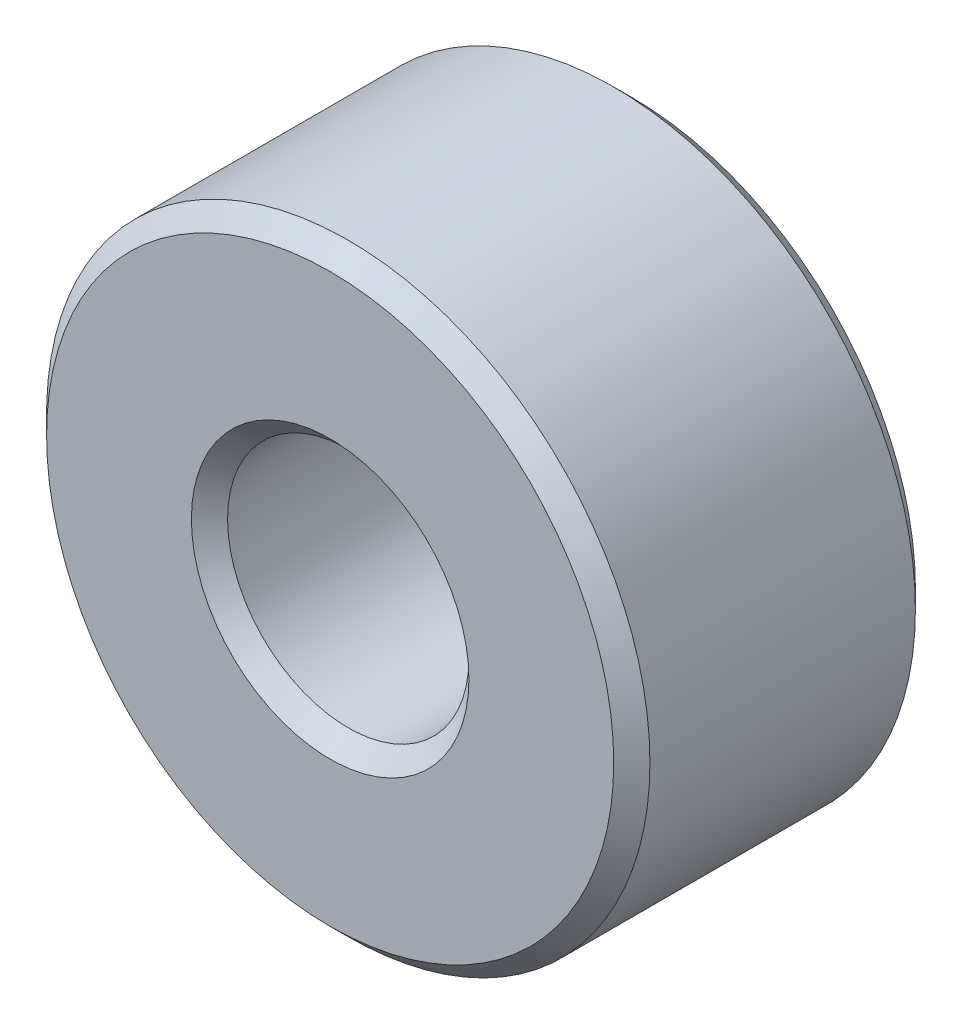
from build123d import *

# Parameters (mm, degrees)
BOSS_EXTRUDE1_DEPTH      = 2
BOSS_EXTRUDE1_DEPTH_BACK = 2
SKETCH3_R                = 4
SKETCH3_R_2              = 1.6
CHAMFER1_SIZE            = 0.24


with BuildPart() as part:
    # Sketch3 → Boss-Extrude1 (new, two sides: drawn at the far end of the back side and taken through both)
    with BuildSketch(Plane.XY.offset(-BOSS_EXTRUDE1_DEPTH_BACK)):
        Circle(SKETCH3_R)
        Circle(SKETCH3_R_2, mode=Mode.SUBTRACT)
    extrude(amount=BOSS_EXTRUDE1_DEPTH + BOSS_EXTRUDE1_DEPTH_BACK)

    # Chamfer1
    chamfer1_edges = [part.edges().sort_by_distance(p)[0] for p in [
        (-4, 0, -2),
        (-1.6, 0, -2),
        (-4, 0, 2),
        (-1.6, 0, 2),
    ]]
    chamfer(chamfer1_edges, length=CHAMFER1_SIZE)


solid = part.part
